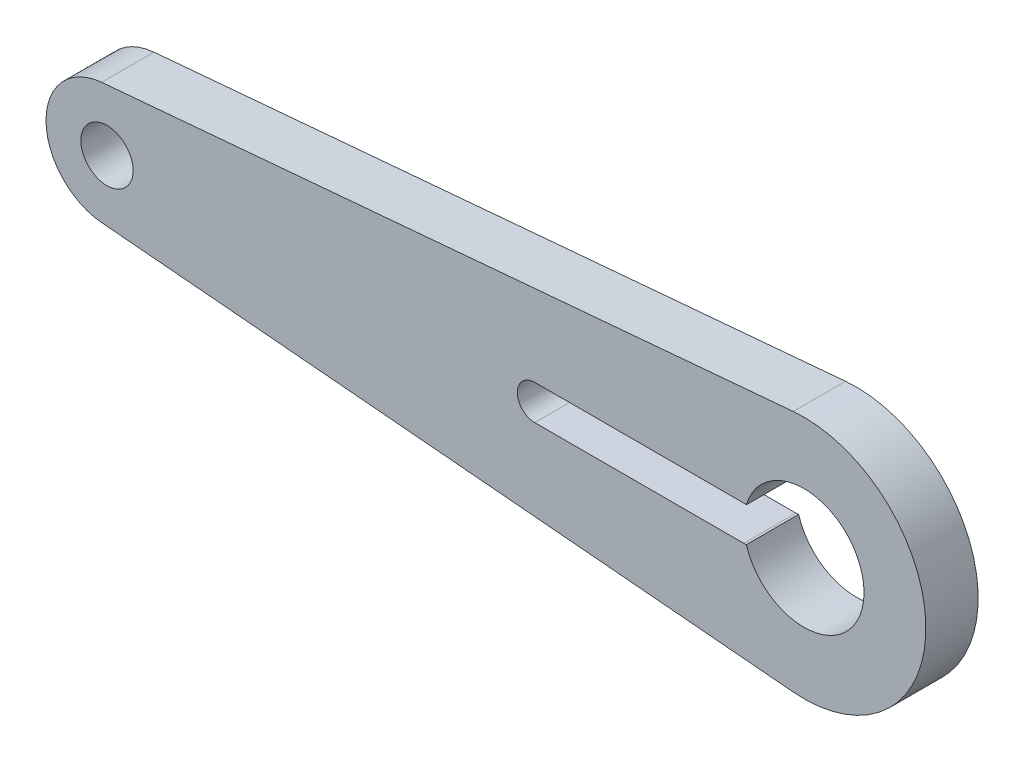
from build123d import *

# Parameters (mm, degrees)
SKETCH1_R           = 1.5
BOSS_EXTRUDE1_DEPTH = 3


with BuildPart() as part:
    # Sketch1 → Boss-Extrude1 (new body)
    with BuildSketch(Plane.XY):
        with BuildLine():
            Line((-0.6125, 6.973151637), (-40.30625, 3.486575818))
            ThreePointArc((-40.30625, 3.486575818), (-43.5, 0), (-40.30625, -3.486575818))
            Line((-40.30625, -3.486575818), (-0.6125, -6.973151637))
            ThreePointArc((-0.6125, -6.973151637), (7, 0), (-0.6125, 6.973151637))
        make_face()
        with Locations((-40, 0)):
            Circle(SKETCH1_R, mode=Mode.SUBTRACT)
        with BuildLine():
            ThreePointArc((-3.305072464, -0.989442272), (-3.377344208, -0.997357075), (-3.45, -1))
            Line((-3.45, -1), (-15.45, -1))
            ThreePointArc((-15.45, -1), (-16.45, 0), (-15.45, 1))
            Line((-15.45, 1), (-3.45, 1))
            ThreePointArc((-3.45, 1), (-3.377344208, 0.997357075), (-3.305072464, 0.989442272))
            ThreePointArc((-3.305072464, 0.989442272), (0.5, 3.413575838), (3.45, 0))
            ThreePointArc((3.45, 0), (0.5, -3.413575838), (-3.305072464, -0.989442272))
        make_face(mode=Mode.SUBTRACT)
    extrude(amount=BOSS_EXTRUDE1_DEPTH)


solid = part.part
